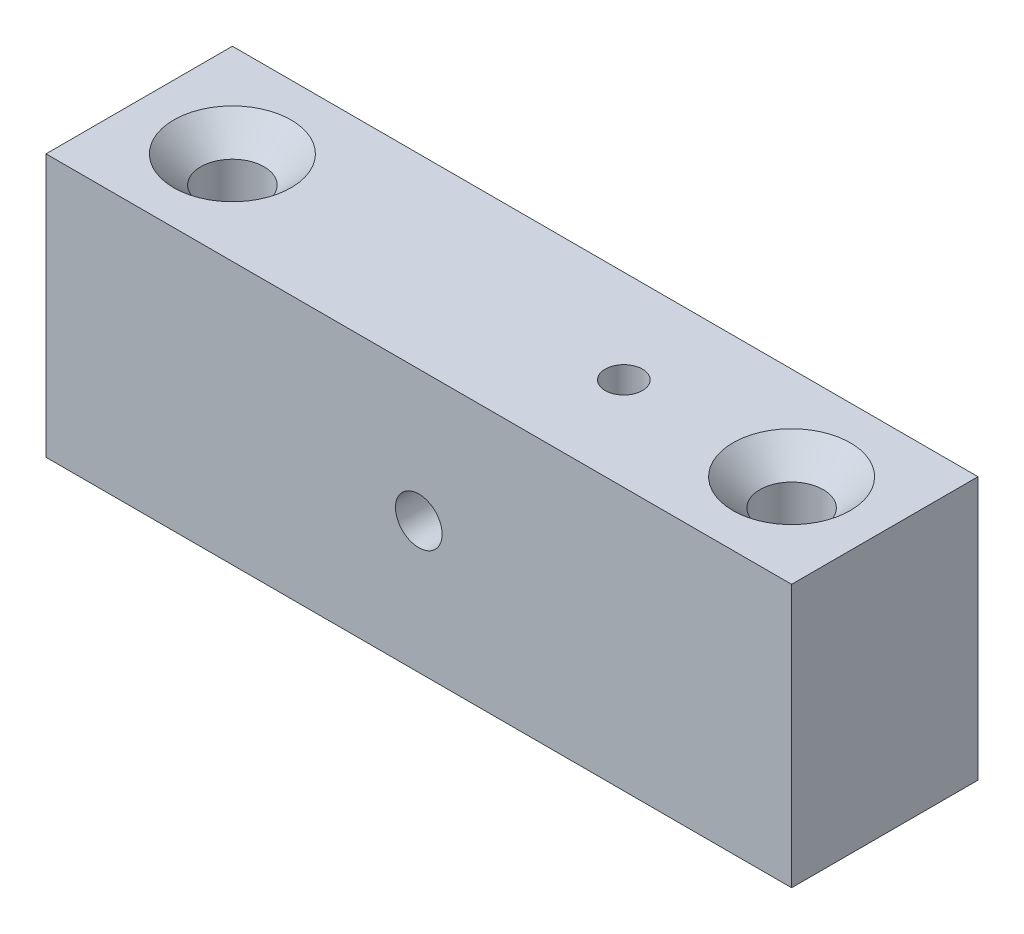
from build123d import *

# Parameters (mm, degrees)
SKETCH1_W                                       = 40
SKETCH1_H                                       = 10
BOSS_EXTRUDE1_DEPTH                             = 14.1
CSK_FOR_M3_FLAT_HEAD_MACHINE_SCREW1_D           = 3.4
CSK_FOR_M3_FLAT_HEAD_MACHINE_SCREW1_CSINK_D     = 6.3
CSK_FOR_M3_FLAT_HEAD_MACHINE_SCREW1_CSINK_ANGLE = 90
M3X0_5_TAPPED_HOLE1_D                           = 2.5
F_2_0MM_DOWEL_HOLE1_D                           = 2


with BuildPart() as part:
    # Sketch1 → Boss-Extrude1 (new body)
    with BuildSketch(Plane(origin=(0, 0, 0), x_dir=(1, 0, 0), z_dir=(0, 1, 0))):
        with Locations((20, 5)):
            Rectangle(SKETCH1_W, SKETCH1_H)
    extrude(amount=BOSS_EXTRUDE1_DEPTH)

    # CSK for M3 Flat Head Machine Screw1 (through all)
    with Locations(Plane(origin=(5, 14.1, -5), x_dir=(0, 0, 1), z_dir=(0, 1, 0))):
        with Locations((0, 0), (0, 30)):
            CounterSinkHole(CSK_FOR_M3_FLAT_HEAD_MACHINE_SCREW1_D / 2, CSK_FOR_M3_FLAT_HEAD_MACHINE_SCREW1_CSINK_D / 2, counter_sink_angle=CSK_FOR_M3_FLAT_HEAD_MACHINE_SCREW1_CSINK_ANGLE)

    # M3x0.5 Tapped Hole1 (through all)
    with Locations(Plane(origin=(20, 7.05, -10), x_dir=(-1, 0, 0), z_dir=(0, 0, -1))):
        with Locations((0, 0)):
            Hole(M3X0_5_TAPPED_HOLE1_D / 2)

    # Ø2.0mm Dowel Hole1 (through all)
    with Locations(Plane(origin=(26, 14.1, -5), x_dir=(0, 0, 1), z_dir=(0, 1, 0))):
        with Locations((0, 0)):
            Hole(F_2_0MM_DOWEL_HOLE1_D / 2)


solid = part.part
